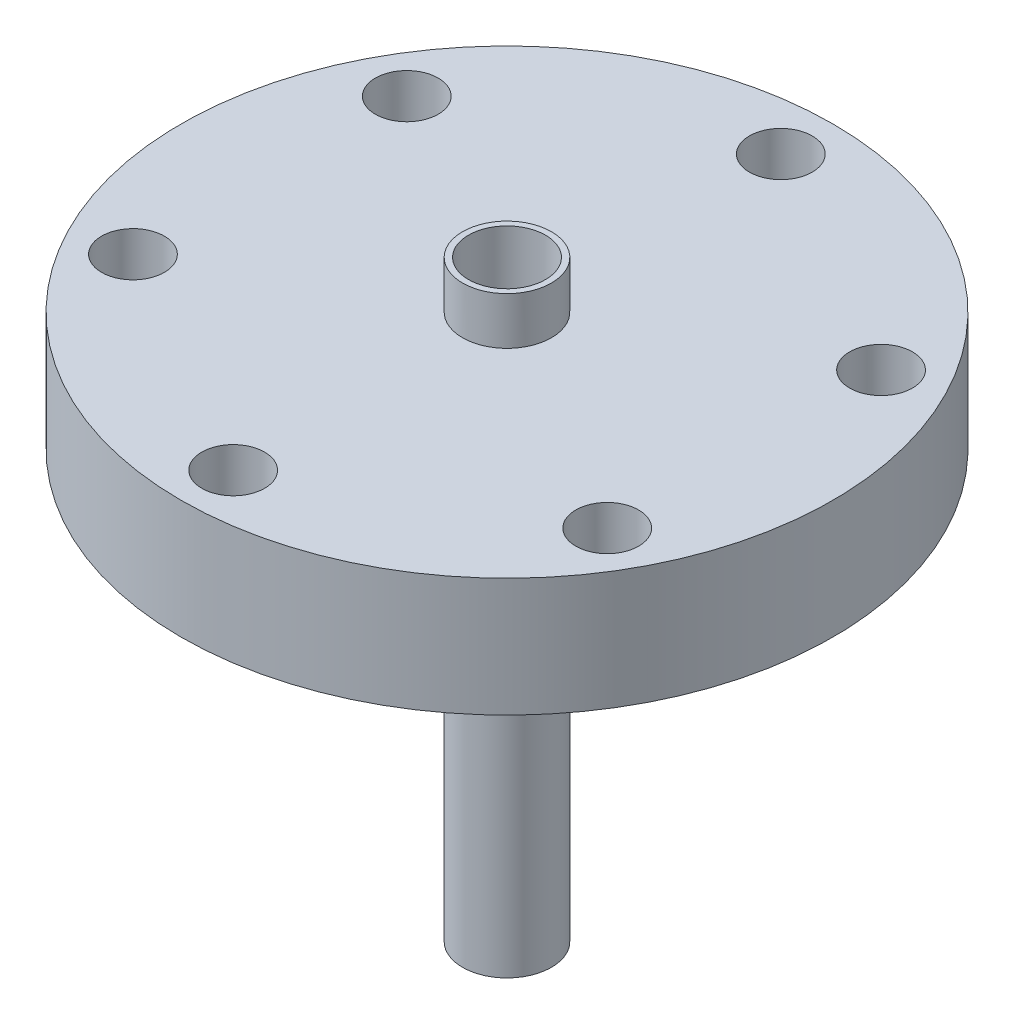
from build123d import *

# Parameters (mm, degrees)
SKETCH1_R                = 34.925
EXTRUDE1_DEPTH           = 12.7
SKETCH2_R                = 4.7625
CUT_EXTRUDE1_DEPTH       = 51.998051433
SKETCH3_R                = 3.3655
CUT_EXTRUDE2_DEPTH       = 51.998051433
CIRPATTERN1_COUNT        = 6
EXTRUDE_THIN1_DEPTH      = 45.72
EXTRUDE_THIN1_DEPTH_BACK = 17.78
SKETCH5_R                = 4.7625
SKETCH5_R_2              = 4.1275


with BuildPart() as part:
    # Sketch1 → Extrude1 (new body)
    with BuildSketch(Plane(origin=(0, 0, 0), x_dir=(1, 0, 0), z_dir=(0, 1, 0))):
        Circle(SKETCH1_R)
    extrude(amount=EXTRUDE1_DEPTH)

    # Sketch2 → Cut-Extrude1 (cut, through all)
    with BuildSketch(Plane(origin=(0, 0, 0), x_dir=(1, 0, 0), z_dir=(0, 1, 0))):
        Circle(SKETCH2_R)
    extrude(amount=CUT_EXTRUDE1_DEPTH, mode=Mode.SUBTRACT)

    # Sketch3 → Cut-Extrude2 (cut, through all)
    with BuildSketch(Plane(origin=(0, 0, 0), x_dir=(1, 0, 0), z_dir=(0, 1, 0))):
        with Locations((0, 29.337)):
            Circle(SKETCH3_R)
    cut_extrude2 = extrude(amount=CUT_EXTRUDE2_DEPTH, mode=Mode.SUBTRACT)

    # CirPattern1: Cut-Extrude2 ×6 about axis
    cirpattern1_axis = Axis((0, 35.858162691, 0), (0, -1, 0))
    for i in range(1, CIRPATTERN1_COUNT):
        add(cut_extrude2.rotate(cirpattern1_axis, i * 360 / CIRPATTERN1_COUNT), mode=Mode.SUBTRACT)

    # Sketch5 → Extrude-Thin1 (add, two sides: drawn at the far end of the back side and taken through both)
    with BuildSketch(Plane.XZ.offset(-EXTRUDE_THIN1_DEPTH_BACK)):
        Circle(SKETCH5_R)
        Circle(SKETCH5_R_2, mode=Mode.SUBTRACT)
    extrude(amount=EXTRUDE_THIN1_DEPTH + EXTRUDE_THIN1_DEPTH_BACK)


solid = part.part
